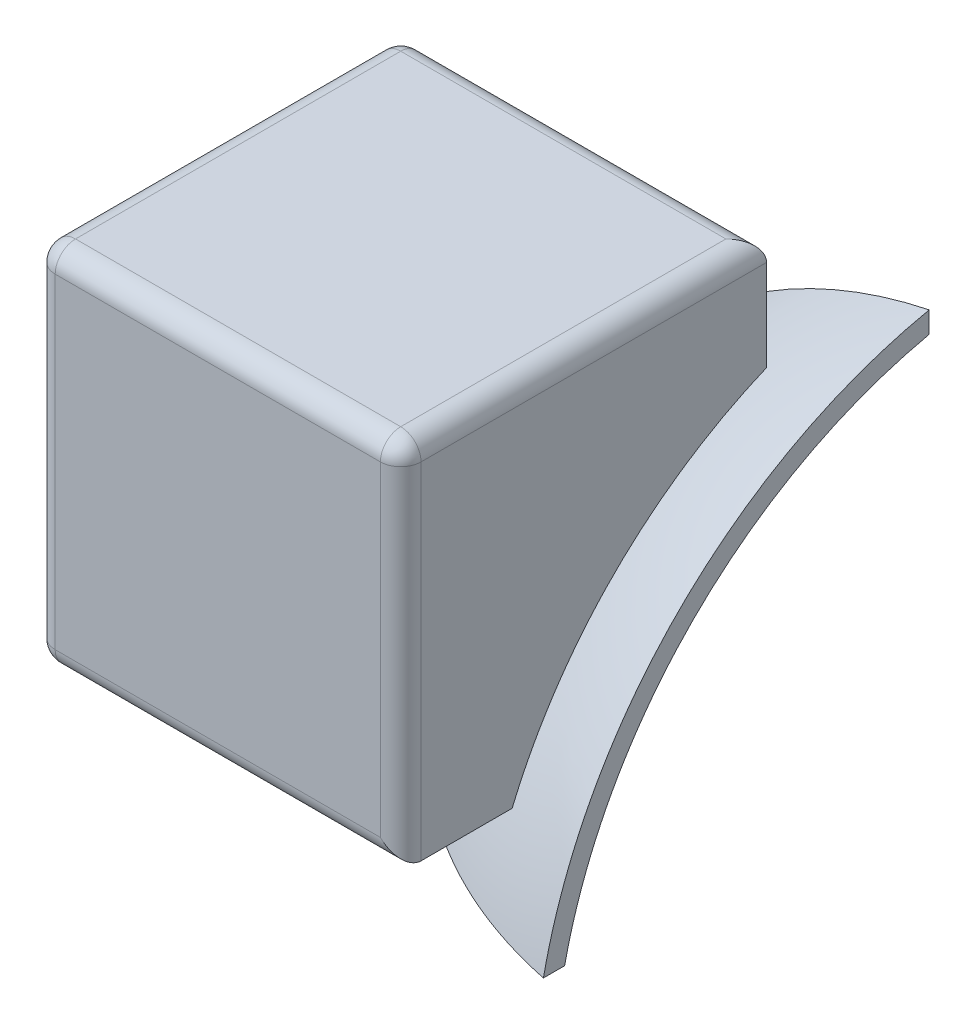
from build123d import *

# Parameters (mm, degrees)
SKETCH_1_W          = 54
SKETCH_1_H          = 54
EXTRUDE_1_DEPTH     = 27
CUT_EXTRUDE_2_DEPTH = 54
SKETCH_4_W          = 36
SKETCH_4_H          = 18
CUT_EXTRUDE_3_DEPTH = 43.213741838
FILLET_2_R          = 1
REVOLVE_8_ANGLE     = 90
SKETCH_8_W          = 28.0496759
SKETCH_8_H          = 27.957000759
CUT_EXTRUDE_4_DEPTH = 45.068129073
SKETCH_9_W          = 27.76443714
SKETCH_9_H          = 23.535416913
CUT_EXTRUDE_5_DEPTH = 45.068129073
SKETCH_10_W         = 23.194528254
SKETCH_10_H         = 22.885611119
CUT_EXTRUDE_6_DEPTH = 54
SCALE_2_SCALE       = 2.083333333


with BuildPart() as part:
    # 草图1 → 凸台-拉伸1 (new, symmetric)
    with BuildSketch(Plane(origin=(0, 0, 0), x_dir=(1, 0, 0), z_dir=(0, 1, 0))):
        Rectangle(SKETCH_1_W, SKETCH_1_H)
    extrude(amount=EXTRUDE_1_DEPTH, both=True)

    # 草图2 → 切除-拉伸2 (cut)
    with BuildSketch(Plane.ZY.offset(27)):
        Polygon((9, 27), (-27, 27), (-27, -27), (27, -27), (27, 9), (9, 9), align=None)
    extrude(amount=-CUT_EXTRUDE_2_DEPTH, mode=Mode.SUBTRACT)

    # 草图4 → 切除-拉伸3 (cut, through all)
    with BuildSketch(Plane(origin=(0, 27, 0), x_dir=(1, 0, 0), z_dir=(0, 1, 0))):
        with Locations((9, -18)):
            Rectangle(SKETCH_4_W, SKETCH_4_H)
    extrude(amount=-CUT_EXTRUDE_3_DEPTH, mode=Mode.SUBTRACT)

    # 圆角2
    fillet_2_edges = [part.edges().sort_by_distance(p)[0] for p in [
        (-18, 27, 27),
        (-27, 27, 18),
        (-27, 18, 9),
        (-27, 9, 18),
        (-18, 9, 27),
        (-18, 27, 9),
        (-9, 18, 27),
        (-9, 27, 18),
        (-27, 18, 27),
    ]]
    fillet(fillet_2_edges, radius=FILLET_2_R)

    # 草图5 → 切除-旋转6 (revolve, cut)
    with BuildSketch(Plane(origin=(0, 0, 0), x_dir=(1, 0, 0), z_dir=(0, 1, 0))):
        with BuildLine():
            Line((0, -25), (0, 25))
            ThreePointArc((0, 25), (-25, 0), (0, -25))
        make_face()
    revolve(axis=Axis((0, 0, 25), (0, 0, -1)), mode=Mode.SUBTRACT)


with BuildPart() as body_2:
    # 草图6 → 旋转8 (revolve)
    with BuildSketch(Plane(origin=(0, 0, 0), x_dir=(1, 0, 0), z_dir=(0, 1, 0))):
        with BuildLine():
            Line((-24, 0), (-25, 0))
            ThreePointArc((-25, 0), (-17.67766953, -17.67766953), (0, -25))
            Line((0, -25), (0, -24))
            ThreePointArc((0, -24), (-16.970562748, -16.970562748), (-24, 0))
        make_face()
    revolve(axis=Axis((0, 0, 25), (0, 0, -1)), revolution_arc=REVOLVE_8_ANGLE)

    # 草图8 → 切除-拉伸4 (cut, through all)
    with BuildSketch(Plane.XY.offset(5)):
        with Locations((-13.438216573, 13.330095576)):
            Rectangle(SKETCH_8_W, SKETCH_8_H)
    extrude(amount=-CUT_EXTRUDE_4_DEPTH, mode=Mode.SUBTRACT)

    # 草图9 → 切除-拉伸5 (cut, through all)
    with BuildSketch(Plane(origin=(0, 5, 0), x_dir=(1, 0, 0), z_dir=(0, 1, 0))):
        with Locations((-13.547684968, -15.66850606)):
            Rectangle(SKETCH_9_W, SKETCH_9_H)
    extrude(amount=-CUT_EXTRUDE_5_DEPTH, mode=Mode.SUBTRACT)

    # 草图10 → 切除-拉伸6 (cut)
    with BuildSketch(Plane(origin=(-5, 0, 0), x_dir=(0, 0, -1), z_dir=(1, 0, 0))):
        with Locations((-15.526919039, 15.634156075)):
            Rectangle(SKETCH_10_W, SKETCH_10_H)
    extrude(amount=CUT_EXTRUDE_6_DEPTH, mode=Mode.SUBTRACT)


with BuildPart() as part_1:
    # 缩放比例2: scaled about (0, 0, 0)
    add(part.part.scale(SCALE_2_SCALE))


with BuildPart() as body_2_1:
    # 缩放比例2: scaled about (0, 0, 0)
    add(body_2.part.scale(SCALE_2_SCALE))


solid = Compound([part_1.part, body_2_1.part])
